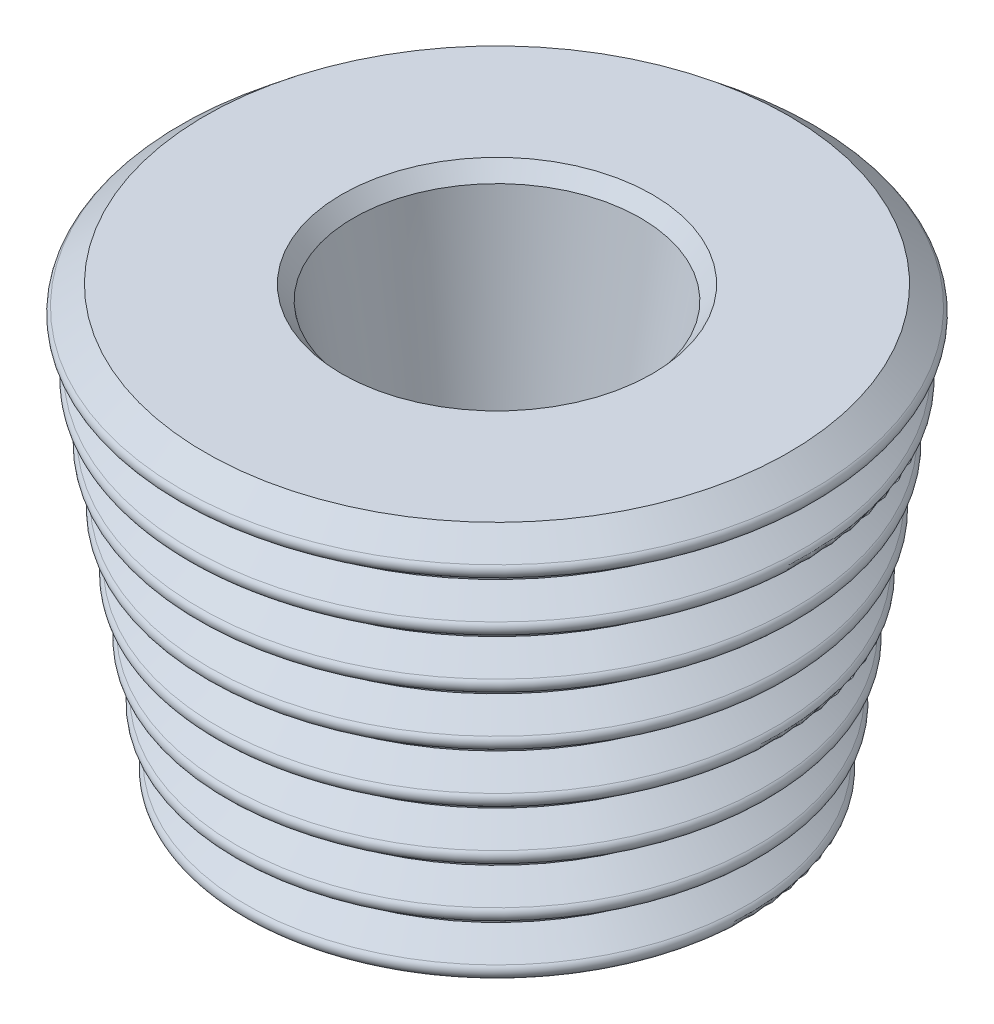
from build123d import *

# Parameters (mm, degrees)
CHANFREIN1_SIZE  = 0.5
CHANFREIN1_SIZE2 = 0.323816285
CHANFREIN2_SIZE  = 0.25
CHANFREIN2_SIZE2 = 0.217241519


with BuildPart() as part:
    # Esquisse1 → Révolution1 (revolve)
    with BuildSketch(Plane.XY, mode=Mode.PRIVATE) as r_volution1_sk:
        Polygon((5, 15), (10, 15), (7.5, 0), (2.5, 0), align=None)
        with BuildLine():
            Line((10.823759757, 14.321854177), (10, 15))
            Line((10, 15), (9.753401519, 13.520409114))
            Line((9.753401519, 13.520409114), (10.752572908, 13.894733079))
            ThreePointArc((10.752572908, 13.894733079), (10.911465573, 14.087743755), (10.823759757, 14.321854177))
        make_face()
        with BuildLine():
            Line((10.503181732, 12.398386026), (9.679421975, 13.076531849))
            Line((9.679421975, 13.076531849), (9.432823494, 11.596940963))
            Line((9.432823494, 11.596940963), (10.431994882, 11.971264928))
            ThreePointArc((10.431994882, 11.971264928), (10.590887548, 12.164275603), (10.503181732, 12.398386026))
        make_face()
        with BuildLine():
            Line((10.182603707, 10.474917874), (9.35884395, 11.153063697))
            Line((9.35884395, 11.153063697), (9.112245469, 9.673472811))
            Line((9.112245469, 9.673472811), (10.111416857, 10.047796776))
            ThreePointArc((10.111416857, 10.047796776), (10.270309522, 10.240807452), (10.182603707, 10.474917874))
        make_face()
        with BuildLine():
            Line((9.862025681, 8.551449723), (9.038265924, 9.229595546))
            Line((9.038265924, 9.229595546), (8.791667443, 7.75000466))
            Line((8.791667443, 7.75000466), (9.790838832, 8.124328625))
            ThreePointArc((9.790838832, 8.124328625), (9.949731497, 8.3173393), (9.862025681, 8.551449723))
        make_face()
        with BuildLine():
            Line((7.755953823, 1.53572294), (7.509355342, 0.056132054))
            Line((7.509355342, 0.056132054), (8.508526731, 0.430456019))
            ThreePointArc((8.508526731, 0.430456019), (8.667419396, 0.623466695), (8.57971358, 0.857577117))
            Line((8.57971358, 0.857577117), (7.755953823, 1.53572294))
        make_face()
        with BuildLine():
            Line((8.076531849, 3.459191091), (7.829933368, 1.979600205))
            Line((7.829933368, 1.979600205), (8.829104756, 2.35392417))
            ThreePointArc((8.829104756, 2.35392417), (8.987997421, 2.546934846), (8.900291606, 2.781045269))
            Line((8.900291606, 2.781045269), (8.076531849, 3.459191091))
        make_face()
        with BuildLine():
            Line((8.397109874, 5.382659243), (8.150511393, 3.903068357))
            Line((8.150511393, 3.903068357), (9.149682781, 4.277392322))
            ThreePointArc((9.149682781, 4.277392322), (9.308575447, 4.470402998), (9.220869631, 4.70451342))
            Line((9.220869631, 4.70451342), (8.397109874, 5.382659243))
        make_face()
        with BuildLine():
            Line((8.717687899, 7.306127394), (8.471089418, 5.826536508))
            Line((8.471089418, 5.826536508), (9.470260807, 6.200860473))
            ThreePointArc((9.470260807, 6.200860473), (9.629153472, 6.393871149), (9.541447656, 6.627981571))
            Line((9.541447656, 6.627981571), (8.717687899, 7.306127394))
        make_face()
    revolve(r_volution1_sk.sketch.rotate(Axis((0, 0, 0), (0, 1, 0)), 90), axis=Axis((0, 0, 0), (0, 1, 0)))

    # Chanfrein1
    chanfrein1_edges = [part.edges().sort_by_distance(p)[0] for p in [
        (0, 15, 5),
    ]]
    chanfrein1_side = [part.faces().sort_by_distance(p)[0] for p in [
        (0, 7.5, 3.75),
    ]]
    chamfer(chanfrein1_edges, length=CHANFREIN1_SIZE, length2=CHANFREIN1_SIZE2, reference=chanfrein1_side[0])

    # Chanfrein2
    chanfrein2_edges = [part.edges().sort_by_distance(p)[0] for p in [
        (0, 0, 2.5),
    ]]
    chanfrein2_side = [part.faces().sort_by_distance(p)[0] for p in [
        (0, 0, 7.287867966),
    ]]
    chamfer(chanfrein2_edges, length=CHANFREIN2_SIZE, length2=CHANFREIN2_SIZE2, reference=chanfrein2_side[0])


solid = part.part
